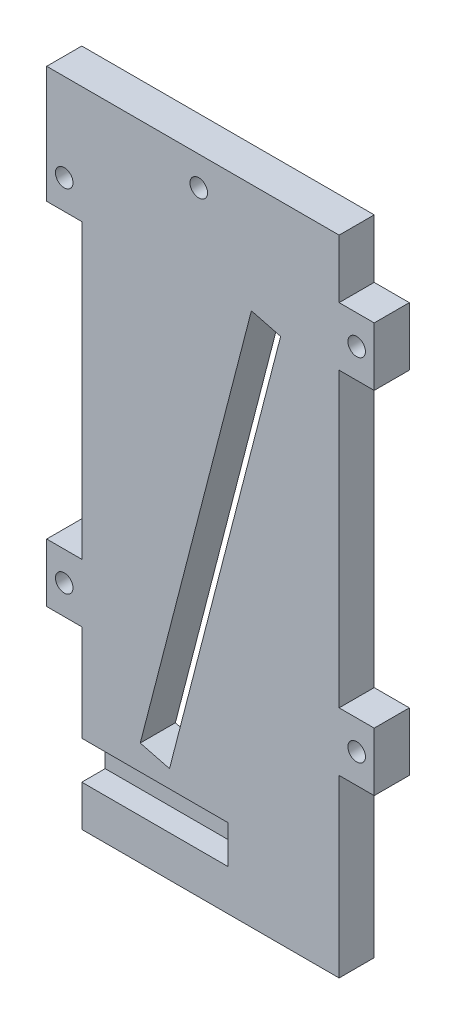
from build123d import *

# Parameters (mm, degrees)
BOSS_EXTRU_1_DEPTH       = 6
ESQUISSE2_R              = 1.5
ENL_V_MAT_EXTRU_1_DEPTH  = 6
ESQUISSE5_R              = 1.5
ENL_V_MAT_EXTRU_6_DEPTH  = 6
ESQUISSE6_R              = 2.995
ENL_V_MAT_EXTRU_7_DEPTH  = 3
ESQUISSE9_W              = 44
ESQUISSE9_H              = 20
BOSS_EXTRU_3_DEPTH       = 6
ESQUISSE10_W             = 25
ESQUISSE10_H             = 6.5
ENL_V_MAT_EXTRU_9_DEPTH  = 4
ENL_V_MAT_EXTRU_11_DEPTH = 6


with BuildPart() as part:
    # Esquisse1 → Boss.-Extru.1 (new body)
    with BuildSketch(Plane.XY):
        Polygon((-6, 90), (-6, 70), (0, 70), (0, 20), (-6, 20), (-6, 10), (0, 10), (0, 0), (44, 0), (44, 10), (50, 10), (50, 20), (44, 20), (44, 70), (50, 70), (50, 80), (44, 80), (44, 90), align=None)
    extrude(amount=BOSS_EXTRU_1_DEPTH)

    # Esquisse2 → Enlèv. mat.-Extru.1 (cut)
    with BuildSketch(Plane.XY.offset(6)):
        with Locations((20, 85)):
            Circle(ESQUISSE2_R)
    extrude(amount=-ENL_V_MAT_EXTRU_1_DEPTH, mode=Mode.SUBTRACT)

    # Esquisse5 → Enlèv. mat.-Extru.6 (cut)
    with BuildSketch(Plane(origin=(0, 0, 0), x_dir=(-1, 0, 0), z_dir=(0, 0, -1))):
        with Locations((3, 75)):
            Circle(ESQUISSE5_R)
        with Locations((3, 15)):
            Circle(ESQUISSE5_R)
        with Locations(Location((-47, 15, 0), (0, 0, 180))):
            Circle(ESQUISSE5_R)
        with Locations(Location((-47, 75, 0), (0, 0, 180))):
            Circle(ESQUISSE5_R)
    extrude(amount=-ENL_V_MAT_EXTRU_6_DEPTH, mode=Mode.SUBTRACT)

    # Esquisse6 → Enlèv. mat.-Extru.7 (cut)
    with BuildSketch(Plane(origin=(0, 0, 0), x_dir=(-1, 0, 0), z_dir=(0, 0, -1))):
        with Locations((3, 15)):
            Circle(ESQUISSE6_R)
        with Locations((3, 75)):
            Circle(ESQUISSE6_R)
        with Locations(Location((-47, 75, 0), (0, 0, 180))):
            Circle(ESQUISSE6_R)
        with Locations(Location((-47, 15, 0), (0, 0, 180))):
            Circle(ESQUISSE6_R)
    extrude(amount=-ENL_V_MAT_EXTRU_7_DEPTH, mode=Mode.SUBTRACT)

    # Esquisse9 → Boss.-Extru.3 (add)
    with BuildSketch(Plane.XY.offset(6)):
        with Locations((22, -10)):
            Rectangle(ESQUISSE9_W, ESQUISSE9_H)
    extrude(amount=-BOSS_EXTRU_3_DEPTH)

    # Esquisse10 → Enlèv. mat.-Extru.9 (cut)
    with BuildSketch(Plane.XY.offset(6)):
        with Locations((12.5, -9.75)):
            Rectangle(ESQUISSE10_W, ESQUISSE10_H)
    extrude(amount=-ENL_V_MAT_EXTRU_9_DEPTH, mode=Mode.SUBTRACT)

    # Esquisse11 → Enlèv. mat.-Extru.11 (cut)
    with BuildSketch(Plane.XY.offset(6)):
        Polygon((29, 71.292517007), (10, -2.207482993), (15, -3.5), (34, 70), align=None)
    extrude(amount=-ENL_V_MAT_EXTRU_11_DEPTH, mode=Mode.SUBTRACT)


solid = part.part
